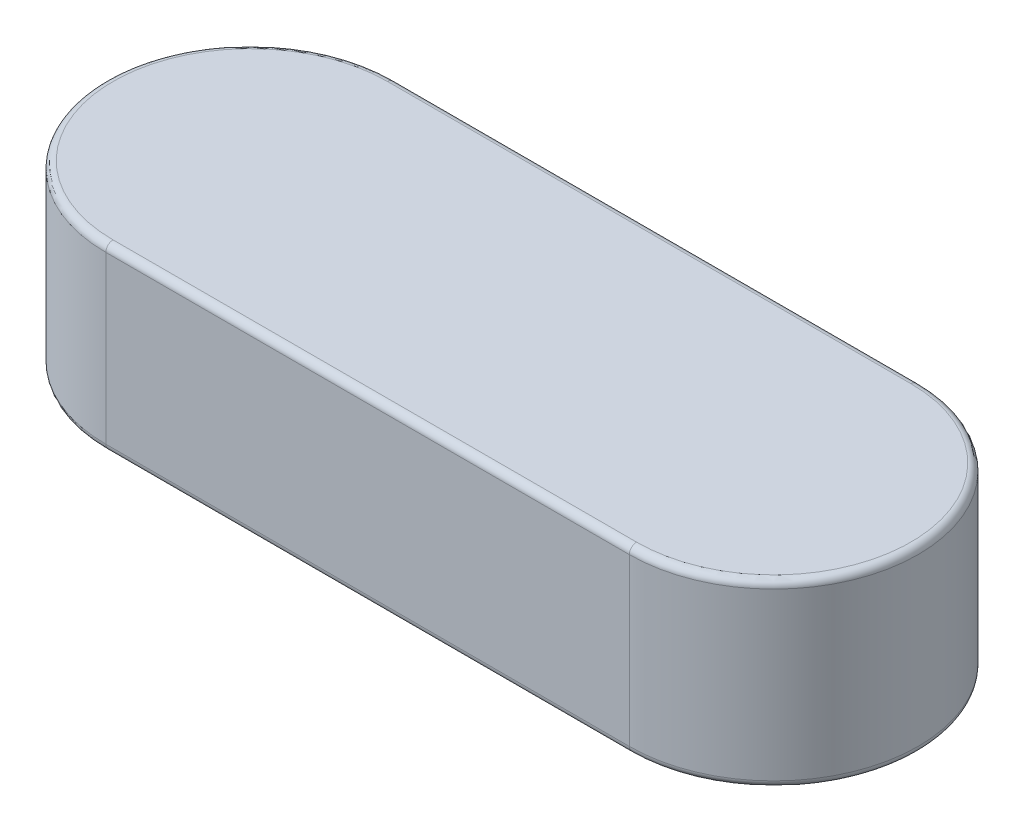
from build123d import *

# Parameters (mm, degrees)
EXTRUDE1_DEPTH = 10
FILLET1_R      = 0.4


with BuildPart() as part:
    # Sketch1 → Extrude1 (new body)
    with BuildSketch(Plane(origin=(0, 0, 0), x_dir=(1, 0, 0), z_dir=(0, 1, 0))):
        with BuildLine():
            Line((-29, 8), (0, 8))
            ThreePointArc((0, 8), (8, 0), (0, -8))
            Line((0, -8), (-29, -8))
            ThreePointArc((-29, -8), (-37, 0), (-29, 8))
        make_face()
    extrude(amount=EXTRUDE1_DEPTH)

    # Fillet1
    fillet1_edges = [part.edges().sort_by_distance(p)[0] for p in [
        (8, 10, 0),
        (-14.5, 10, -8),
        (-37, 10, 0),
        (-14.5, 0, -8),
        (8, 0, 0),
        (-14.5, 0, 8),
        (-37, 0, 0),
        (-14.5, 10, 8),
    ]]
    fillet(fillet1_edges, radius=FILLET1_R)


solid = part.part
